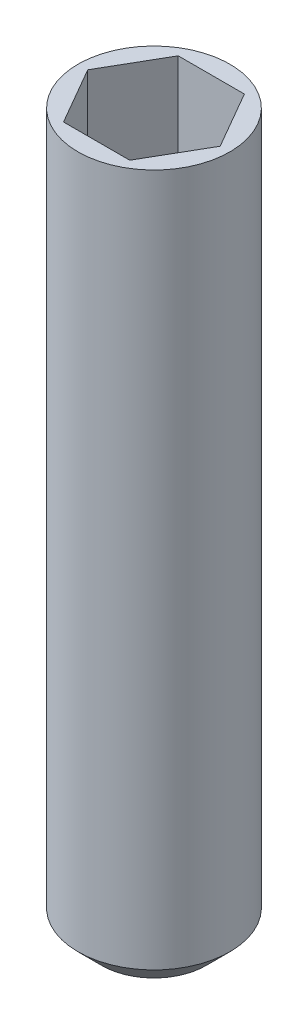
from build123d import *

# Parameters (mm, degrees)
SKETCH1_R           = 2.0193
BOSS_EXTRUDE1_DEPTH = 19.05
CHAMFER1_SIZE       = 0.635
CUT_EXTRUDE1_DEPTH  = 2.54


with BuildPart() as part:
    # Sketch1 → Boss-Extrude1 (new body)
    with BuildSketch(Plane(origin=(0, 0, 0), x_dir=(1, 0, 0), z_dir=(0, 1, 0))):
        with Locations(Location((0, 0, 0), (0, 0, 270))):
            Circle(SKETCH1_R)
    extrude(amount=-BOSS_EXTRUDE1_DEPTH)

    # Chamfer1
    chamfer1_edges = [part.edges().sort_by_distance(p)[0] for p in [
        (0, -19.05, -2.0193),
    ]]
    chamfer(chamfer1_edges, length=CHAMFER1_SIZE)

    # Sketch2 → Cut-Extrude1 (cut)
    with BuildSketch(Plane(origin=(0, 0, 0), x_dir=(1, 0, 0), z_dir=(0, 1, 0))):
        Polygon((-1.75976362, 0), (-0.87988181, -1.524), (0.87988181, -1.524), (1.75976362, 0), (0.87988181, 1.524), (-0.87988181, 1.524), align=None)
    extrude(amount=-CUT_EXTRUDE1_DEPTH, mode=Mode.SUBTRACT)


solid = part.part
